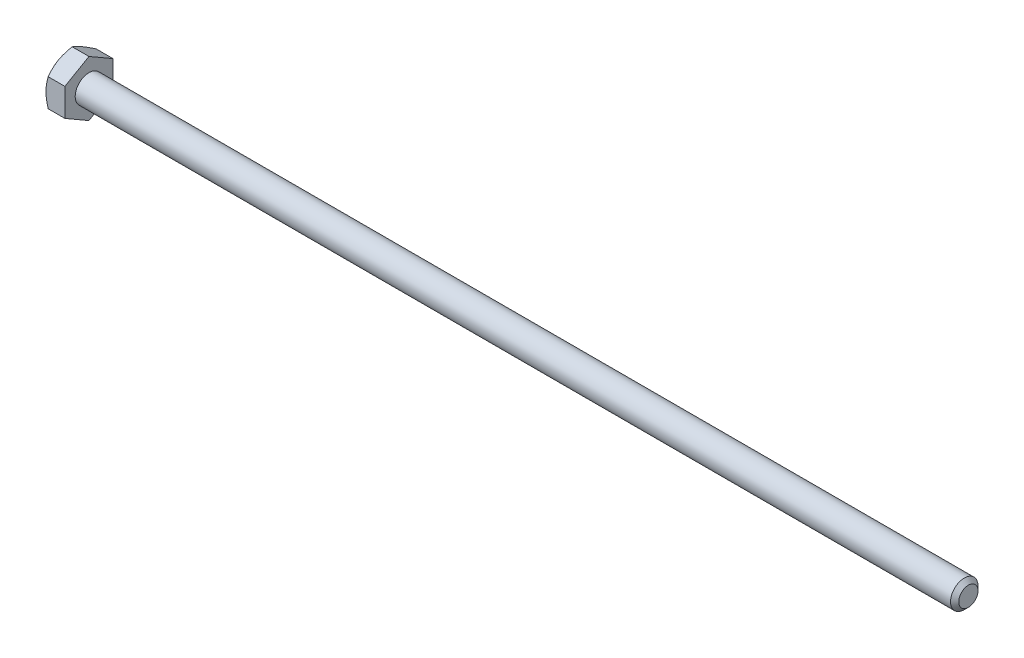
from build123d import *

# Parameters (mm, degrees)
SKETCH5_R           = 3.175
BOSS_EXTRUDE3_DEPTH = 203.2
CHAMFER1_SIZE       = 0.9525
BOSS_EXTRUDE4_DEPTH = 4.365625
SKETCH8_OUTSIDE_W   = 777.858
SKETCH8_OUTSIDE_H   = 779.578
SKETCH8_OUTSIDE_R   = 5.55625
CUT_EXTRUDE3_DEPTH  = 208.739074677
CUT_EXTRUDE3_DRAFT  = -60
CUT_EXTRUDE4_DEPTH  = 0.254
CIRPATTERN1_COUNT   = 6


with BuildPart() as part:
    # Sketch5 → Boss-Extrude3 (new body)
    with BuildSketch(Plane(origin=(103.7828125, 0, 0), x_dir=(0, 0, -1), z_dir=(1, 0, 0))):
        Circle(SKETCH5_R)
    extrude(amount=-BOSS_EXTRUDE3_DEPTH)

    # Chamfer1
    chamfer1_edges = [part.edges().sort_by_distance(p)[0] for p in [
        (103.7828125, 0, 3.175),
    ]]
    chamfer(chamfer1_edges, length=CHAMFER1_SIZE)

    # Sketch11 → Revolve1 (revolve)
    with BuildSketch(Plane.XY):
        Polygon((-99.4171875, 3.175), (-99.4171875, 0), (81.5578125, 0), (78.3828125, 3.175), align=None)
    revolve(axis=Axis((-99.4171875, 0, 0), (1, 0, 0)))

    # Sketch6 → Boss-Extrude4 (add)
    with BuildSketch(Plane.ZY.offset(99.4171875)):
        Polygon((5.55625, 3.207902433), (0, 6.415804866), (-5.55625, 3.207902433), (-5.55625, -3.207902433), (0, -6.415804866), (5.55625, -3.207902433), align=None)
    extrude(amount=BOSS_EXTRUDE4_DEPTH)


with BuildPart() as cut_extrude3_tool:
    # Sketch8 outside → Cut-Extrude3 (with draft: the straight prism first)
    with BuildSketch(Plane.ZY.offset(103.7828125)):
        Rectangle(SKETCH8_OUTSIDE_W, SKETCH8_OUTSIDE_H)
        Circle(SKETCH8_OUTSIDE_R, mode=Mode.SUBTRACT)
    extrude(amount=-CUT_EXTRUDE3_DEPTH)
    # Cut-Extrude3: the draft: its side faces are tilted about the plane it starts from
    cut_extrude3_sides = [cut_extrude3_tool.faces().sort_by_distance(p)[0] for p in [
        (0.586724839, -389.789, 0),
        (0.586724839, 0, 388.929),
        (0.586724839, 389.789, 0),
        (0.586724839, 0, -388.929),
        (0.586724839, 0, -5.55625),
    ]]
    draft(cut_extrude3_sides, Plane.ZY.offset(103.7828125), CUT_EXTRUDE3_DRAFT)


with BuildPart() as part_1:
    add(part.part)

    # Cut-Extrude3: cut by cut_extrude3_tool
    add(cut_extrude3_tool.part, mode=Mode.SUBTRACT)

    # Sketch12 → Cut-Extrude4 (cut)
    with BuildSketch(Plane.ZY.offset(103.7828125)):
        with BuildLine():
            Line((0.1666875, 4.2783125), (0.1666875, 2.3891875))
            ThreePointArc((0.1666875, 2.3891875), (0, 2.2225), (-0.1666875, 2.3891875))
            Line((-0.1666875, 2.3891875), (-0.1666875, 4.2783125))
            ThreePointArc((-0.1666875, 4.2783125), (0, 4.445), (0.1666875, 4.2783125))
        make_face()
    cut_extrude4 = extrude(amount=-CUT_EXTRUDE4_DEPTH, mode=Mode.SUBTRACT)

    # CirPattern1: Cut-Extrude4 ×6 about axis
    cirpattern1_axis = Axis((0, 0, 0), (1, 0, 0))
    for i in range(1, CIRPATTERN1_COUNT):
        add(cut_extrude4.rotate(cirpattern1_axis, i * 360 / CIRPATTERN1_COUNT), mode=Mode.SUBTRACT)


solid = part_1.part
